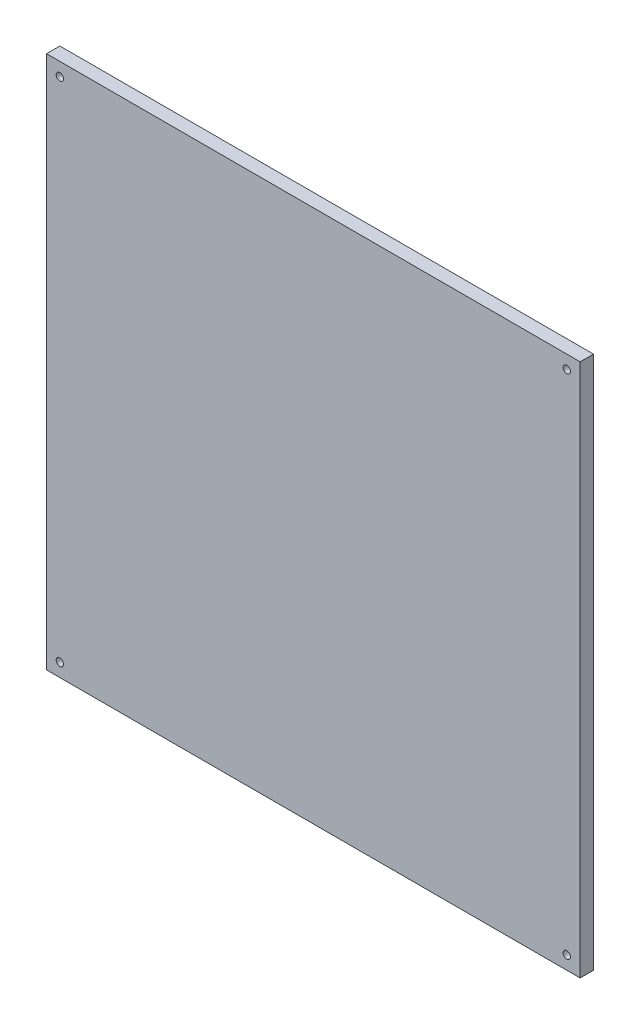
from build123d import *

# Parameters (mm, degrees)
ESQUISSE1_W          = 400
ESQUISSE1_H          = 400
BOSS_EXTRU_1_DEPTH   = 10
D_GAGEMENT_M51_D     = 5.5
D_GAGEMENT_M51_DEPTH = 16


with BuildPart() as part:
    # Esquisse1 → Boss.-Extru.1 (new body)
    with BuildSketch(Plane.XY):
        Rectangle(ESQUISSE1_W, ESQUISSE1_H)
    extrude(amount=BOSS_EXTRU_1_DEPTH)

    # Dégagement M51
    with Locations(Plane.XY.offset(10)):
        with Locations((190, 190), (-190, 190), (-190, -190), (190, -190)):
            Hole(D_GAGEMENT_M51_D / 2, depth=D_GAGEMENT_M51_DEPTH)


solid = part.part
